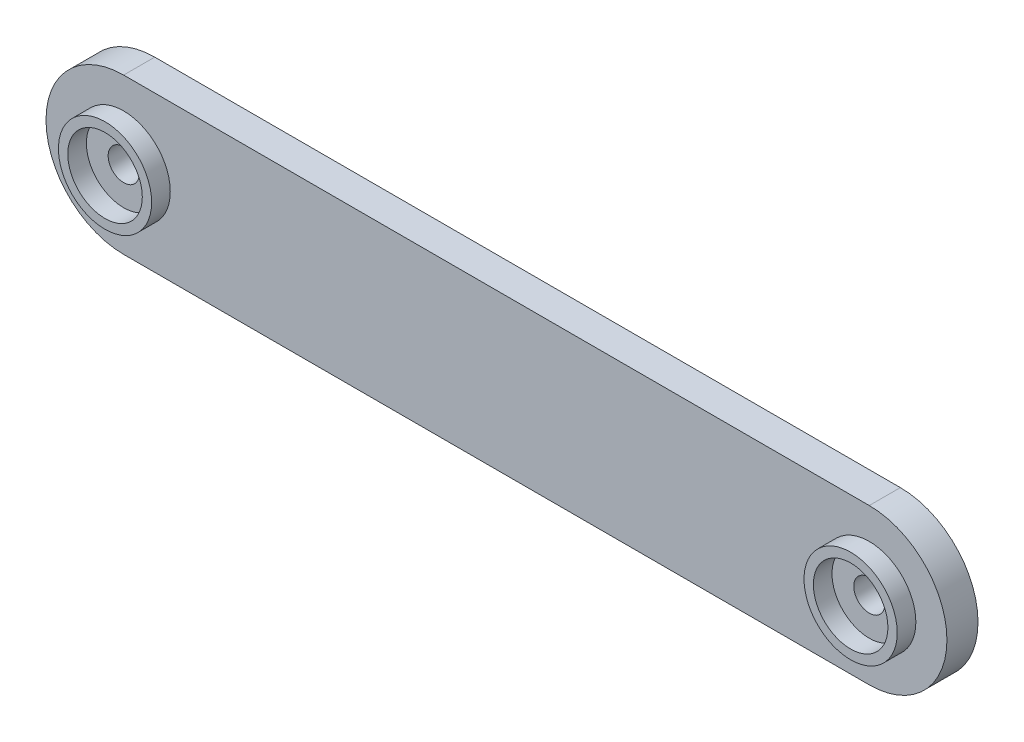
from build123d import *

# Parameters (mm, degrees)
SKETCH1_R           = 12.5
SKETCH1_W           = 120
SKETCH1_H           = 25
BOSS_EXTRUDE2_DEPTH = 5
CUT_EXTRUDE3_REACH  = 136.931
SKETCH3_R           = 2.5
SKETCH3_3_R         = 7.5
SKETCH3_3_R_2       = 6
BOSS_EXTRUDE3_DEPTH = 3


with BuildPart() as part:
    # Sketch1 → Boss-Extrude2 (new body)
    with BuildSketch(Plane.XY):
        with Locations((0, 12.5)):
            Circle(SKETCH1_R)
        with Locations((120, 12.5)):
            Circle(SKETCH1_R)
        with Locations((60, 12.5)):
            Rectangle(SKETCH1_W, SKETCH1_H)
    extrude(amount=BOSS_EXTRUDE2_DEPTH)

    # Sketch3 → Cut-Extrude3 (cut, up to next)
    with BuildSketch(Plane.XY.offset(5), mode=Mode.PRIVATE) as cut_extrude3_sk1:
        with Locations((0, 12.5)):
            Circle(SKETCH3_R)
    cut_extrude3_tool1 = extrude(cut_extrude3_sk1.sketch, amount=-CUT_EXTRUDE3_REACH, mode=Mode.PRIVATE) & part.part
    # Sketch3 → Cut-Extrude3 (cut, up to next)
    with BuildSketch(Plane.XY.offset(5), mode=Mode.PRIVATE) as cut_extrude3_sk2:
        with Locations((120, 12.5)):
            Circle(SKETCH3_R)
    cut_extrude3_tool2 = extrude(cut_extrude3_sk2.sketch, amount=-CUT_EXTRUDE3_REACH, mode=Mode.PRIVATE) & part.part
    add(cut_extrude3_tool1.solids().sort_by_distance((0, 12.5, 5))[0], mode=Mode.SUBTRACT)
    add(cut_extrude3_tool2.solids().sort_by_distance((120, 12.5, 5))[0], mode=Mode.SUBTRACT)

    # Sketch3<3> → Boss-Extrude3 (add)
    # profile 1 of 2: a face of its own
    with BuildSketch(Plane.XY.offset(5)):
        with Locations((0, 12.5)):
            Circle(SKETCH3_3_R)
        with Locations((0, 12.5)):
            Circle(SKETCH3_3_R_2, mode=Mode.SUBTRACT)
    # profile 2 of 2: a face of its own
    with BuildSketch(Plane.XY.offset(5)):
        with Locations((120, 12.5)):
            Circle(SKETCH3_3_R)
        with Locations((120, 12.5)):
            Circle(SKETCH3_3_R_2, mode=Mode.SUBTRACT)
    extrude(amount=BOSS_EXTRUDE3_DEPTH)


solid = part.part
